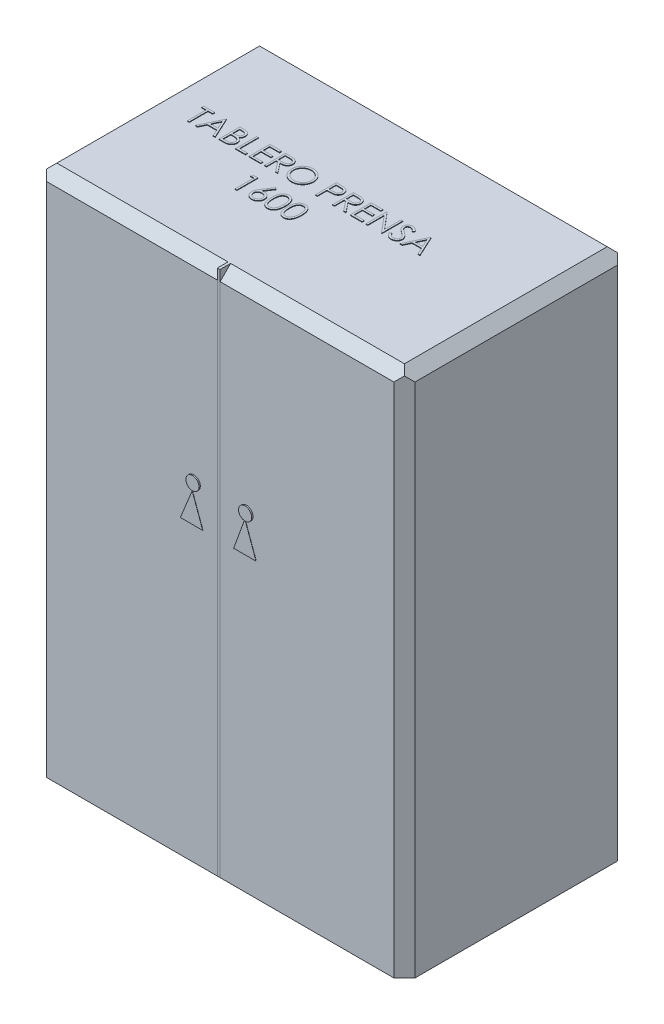
from build123d import *

# Parameters (mm, degrees)
CROQUIS1_W              = 1400
CROQUIS1_H              = 850
SALIENTE_EXTRUIR1_DEPTH = 2000
CROQUIS2_R              = 25
SALIENTE_EXTRUIR2_DEPTH = 5
CROQUIS3_W              = 10
CROQUIS3_H              = 2000
EXTRUIR_L_MINA1_DEPTH   = 0.1
SALIENTE_EXTRUIR3_DEPTH = 1
SALIENTE_EXTRUIR4_DEPTH = 1
CHAFL_N6_SIZE           = 40
CHAFL_N7_SIZE           = 40
CHAFL_N8_SIZE           = 40
CHAFL_N9_SIZE           = 40
CHAFL_N10_SIZE          = 40
CHAFL_N11_SIZE          = 40
CHAFL_N12_SIZE          = 40
CHAFL_N13_SIZE          = 40
CHAFL_N14_SIZE          = 40
SALIENTE_EXTRUIR5_DEPTH = 2
CROQUIS7_W              = 12.905507177
CROQUIS7_H              = 1960
CORTAR_EXTRUIR1_DEPTH   = 1
CROQUIS8_R              = 25.304907672
CORTAR_EXTRUIR2_DEPTH   = 2


with BuildPart() as part:
    # Croquis1 → Saliente-Extruir1 (new body)
    with BuildSketch(Plane(origin=(0, 0, 0), x_dir=(1, 0, 0), z_dir=(0, 1, 0))):
        Rectangle(CROQUIS1_W, CROQUIS1_H)
    extrude(amount=SALIENTE_EXTRUIR1_DEPTH)

    # Croquis2 → Saliente-Extruir2 (add)
    with BuildSketch(Plane.XY.offset(425)):
        with Locations(Location((100, 1250, 0), (0, 0, 180))):
            Circle(CROQUIS2_R)
        with Locations(Location((-100, 1250, 0), (0, 0, 180))):
            Circle(CROQUIS2_R)
    extrude(amount=SALIENTE_EXTRUIR2_DEPTH)

    # Croquis3 → Extruir-Lámina1 (add)
    with BuildSketch(Plane.XY.offset(425)):
        with Locations((-5, 1000)):
            Rectangle(CROQUIS3_W, CROQUIS3_H)
    extrude(amount=EXTRUIR_L_MINA1_DEPTH)

    # Chaflán6
    chafl_n6_edges = [part.edges().sort_by_distance(p)[0] for p in [
        (-700, 2000, 0),
    ]]
    chamfer(chafl_n6_edges, length=CHAFL_N6_SIZE)

    # Chaflán7
    chafl_n7_edges = [part.edges().sort_by_distance(p)[0] for p in [
        (700, 2000, 0),
    ]]
    chamfer(chafl_n7_edges, length=CHAFL_N7_SIZE)

    # Chaflán8
    chafl_n8_edges = [part.edges().sort_by_distance(p)[0] for p in [
        (330, 2000, 425),
    ]]
    chamfer(chafl_n8_edges, length=CHAFL_N8_SIZE)

    # Chaflán9
    chafl_n9_edges = [part.edges().sort_by_distance(p)[0] for p in [
        (-335, 2000, 425),
    ]]
    chamfer(chafl_n9_edges, length=CHAFL_N9_SIZE)

    # Chaflán10
    chafl_n10_edges = [part.edges().sort_by_distance(p)[0] for p in [
        (0, 2000, -425),
    ]]
    chamfer(chafl_n10_edges, length=CHAFL_N10_SIZE)

    # Chaflán11
    chafl_n11_edges = [part.edges().sort_by_distance(p)[0] for p in [
        (-700, 980, 425),
    ]]
    chamfer(chafl_n11_edges, length=CHAFL_N11_SIZE)

    # Chaflán12
    chafl_n12_edges = [part.edges().sort_by_distance(p)[0] for p in [
        (700, 980, 425),
    ]]
    chamfer(chafl_n12_edges, length=CHAFL_N12_SIZE)

    # Chaflán13
    chafl_n13_edges = [part.edges().sort_by_distance(p)[0] for p in [
        (700, 980, -425),
    ]]
    chamfer(chafl_n13_edges, length=CHAFL_N13_SIZE)

    # Chaflán14
    chafl_n14_edges = [part.edges().sort_by_distance(p)[0] for p in [
        (-700, 980, -425),
    ]]
    chamfer(chafl_n14_edges, length=CHAFL_N14_SIZE)

    # Croquis6 → Saliente-Extruir5 (add)
    # profile 1 of 17: a face of its own
    with BuildSketch(Plane(origin=(0, 2000, 0), x_dir=(1, 0, 0), z_dir=(0, 1, 0))):
        Polygon((-566.495652718, 71.233974359), (-566.495652718, 79.375), (-524.772896308, 79.375), (-524.772896308, 71.233974359), (-542.072575795, 71.233974359), (-542.072575795, 0), (-549.195973231, 0), (-549.195973231, 71.233974359), align=None)
    # profile 2 of 17: a face of its own
    with BuildSketch(Plane(origin=(0, 2000, 0), x_dir=(1, 0, 0), z_dir=(0, 1, 0))):
        Polygon((-479.997255282, 79.375), (-443.362639898, 0), (-451.106154521, 0), (-462.840679761, 25.440705128), (-498.823377077, 25.440705128), (-510.891811572, 0), (-518.667127077, 0), (-481.014883487, 79.375), align=None)
        Polygon((-480.585571588, 63.903871194), (-494.959569986, 33.581730769), (-466.593183768, 33.581730769), align=None, mode=Mode.SUBTRACT)
    # profile 3 of 17: a face of its own
    with BuildSketch(Plane(origin=(0, 2000, 0), x_dir=(1, 0, 0), z_dir=(0, 1, 0))):
        with BuildLine():
            Line((-429.115845026, 79.375), (-413.628815779, 79.375))
            add(Edge.make_bspline(
                [(-413.628815779, 79.375), (-412.870705649, 79.371014232), (-411.401299539, 79.363288822), (-409.264537198, 79.243474954), (-407.263180242, 79.080106013), (-405.396648262, 78.82088784), (-403.665803762, 78.508110037), (-402.06543056, 78.129336708), (-400.600617725, 77.675161719), (-398.851811024, 76.952933556), (-396.857896036, 75.879711702), (-394.698932487, 74.293831743), (-392.85280063, 72.354077668), (-391.261075222, 70.165988876), (-389.995585545, 67.758981195), (-389.080067552, 65.190424592), (-388.50045145, 62.493449374), (-388.440842317, 60.641898732), (-388.410716821, 59.706154848)],
                knots=[0, 0, 0, 0, 1.001505555, 1.941167018, 2.826882275, 3.653841531, 4.429895133, 5.150066043, 5.825578002, 6.45369114, 7.647487171, 8.808567382, 9.977351308, 11.170798116, 12.373658725, 13.556498008, 14.765093433, 16, 16, 16, 16], degree=3))
            add(Edge.make_bspline(
                [(-388.410716821, 59.706154848), (-388.435509453, 58.829570103), (-388.484229314, 57.106998413), (-388.950109749, 54.587542721), (-389.679467766, 52.189256151), (-390.693318952, 49.920891339), (-392.010989223, 47.833700469), (-393.572597521, 45.9108464), (-395.456660721, 44.233742072), (-396.868248485, 43.296144103), (-397.585271108, 42.819886819)],
                knots=[0, 0, 0, 0, 1.044552857, 2.05264487, 3.044412934, 4.028983338, 5.005914585, 5.980388656, 6.974128949, 8, 8, 8, 8], degree=3))
            add(Edge.make_bspline(
                [(-397.585271108, 42.819886819), (-396.68356141, 42.47369845), (-394.958367389, 41.811354343), (-392.584238179, 40.640335785), (-390.538747944, 39.366659353), (-388.806169812, 37.975740608), (-387.324405138, 36.476487221), (-386.030525927, 34.84691588), (-384.926501906, 33.065769049), (-383.98051239, 31.151617444), (-383.242353101, 29.124006465), (-382.689542413, 27.001954936), (-382.37278062, 24.793072166), (-382.327703755, 23.289814456), (-382.30494759, 22.530924479)],
                knots=[0, 0, 0, 0, 1.27268992, 2.434971085, 3.483601985, 4.442670788, 5.356604649, 6.2567628, 7.179492994, 8.113709626, 9.066344395, 10.018646069, 10.999752585, 12, 12, 12, 12], degree=3))
            add(Edge.make_bspline(
                [(-382.30494759, 22.530924479), (-382.327101062, 21.756068629), (-382.37068864, 20.231518036), (-382.692270143, 17.991892664), (-383.236762391, 15.851603696), (-383.986768746, 13.796807588), (-384.965628381, 11.831479538), (-386.156887572, 9.953393016), (-387.577281961, 8.181418018), (-389.166207739, 6.495864423), (-390.963759967, 4.980305674), (-392.903135123, 3.630574469), (-395.008757021, 2.520547703), (-397.246043314, 1.588095073), (-399.640091197, 0.875824679), (-402.180150328, 0.377518092), (-404.864030031, 0.041761003), (-406.705751172, 0.014156535), (-407.650250074, 0)],
                knots=[0, 0, 0, 0, 0.978564426, 1.925352924, 2.850884081, 3.763762016, 4.682927383, 5.618979971, 6.567305752, 7.547517671, 8.540179244, 9.531824382, 10.526200242, 11.540722885, 12.589160233, 13.674978461, 14.80764778, 16, 16, 16, 16], degree=3))
            Line((-407.650250074, 0), (-429.115845026, 0))
            Line((-429.115845026, 0), (-429.115845026, 79.375))
        make_face()
        with BuildLine():
            Line((-421.99244759, 71.233974359), (-421.99244759, 45.793269231))
            Line((-421.99244759, 45.793269231), (-417.206414938, 45.793269231))
            add(Edge.make_bspline(
                [(-417.206414938, 45.793269231), (-416.506808329, 45.802338913), (-415.155025788, 45.819863388), (-413.197413849, 45.870062793), (-411.3802929, 46.010625563), (-409.706799543, 46.151147935), (-408.179569117, 46.379625191), (-406.801985115, 46.651589407), (-405.552427649, 46.939219576), (-404.111441527, 47.428384725), (-402.476930017, 48.151324859), (-400.734464977, 49.273275428), (-399.19834397, 50.609595581), (-397.901193463, 52.151533464), (-396.839576185, 53.849391607), (-396.102211573, 55.676079789), (-395.602210664, 57.586072069), (-395.557045578, 58.897307444), (-395.534114257, 59.563050881)],
                knots=[0, 0, 0, 0, 1.156816544, 2.235205308, 3.236616184, 4.169592532, 5.011045266, 5.787822928, 6.49130361, 7.128639758, 8.301311294, 9.436451833, 10.541879658, 11.654887649, 12.756523258, 13.837046038, 14.901820046, 16, 16, 16, 16], degree=3))
            add(Edge.make_bspline(
                [(-395.534114257, 59.563050881), (-395.546047272, 60.003599628), (-395.569455183, 60.867784103), (-395.76116401, 62.127564099), (-396.087000073, 63.312377772), (-396.505517081, 64.43846206), (-397.0903677, 65.470605806), (-397.778967671, 66.444496137), (-398.610946719, 67.326967395), (-399.557942917, 68.151775661), (-400.646709899, 68.883035487), (-401.876598124, 69.523495652), (-403.264247229, 70.039223981), (-404.786270905, 70.490893867), (-406.466097353, 70.808128388), (-408.28434169, 71.072410572), (-410.255896925, 71.206956685), (-411.619901928, 71.224767593), (-412.324979641, 71.233974359)],
                knots=[0, 0, 0, 0, 0.91205012, 1.789085906, 2.630437955, 3.453916878, 4.269457761, 5.079663411, 5.91843418, 6.774407191, 7.675494373, 8.627863946, 9.638891023, 10.736472738, 11.911756761, 13.175263542, 14.539845004, 16, 16, 16, 16], degree=3))
            Line((-412.324979641, 71.233974359), (-421.99244759, 71.233974359))
        make_face(mode=Mode.SUBTRACT)
        with BuildLine():
            Line((-421.99244759, 37.65224359), (-421.99244759, 8.141025641))
            Line((-421.99244759, 8.141025641), (-411.84796642, 8.141025641))
            add(Edge.make_bspline(
                [(-411.84796642, 8.141025641), (-411.121822922, 8.149728484), (-409.722277058, 8.166502066), (-407.701588446, 8.221260714), (-405.828721628, 8.345817681), (-404.112222835, 8.5418932), (-402.533557213, 8.754583029), (-401.111662876, 9.040588864), (-399.835013668, 9.368270648), (-398.354685617, 9.874777768), (-396.687731054, 10.661644162), (-394.89134199, 11.848056083), (-393.294175971, 13.26145967), (-391.937878128, 14.897285759), (-390.826333567, 16.675996209), (-390.017718782, 18.561613967), (-389.518997567, 20.522982178), (-389.458623371, 21.86026298), (-389.428345026, 22.530924479)],
                knots=[0, 0, 0, 0, 1.160039823, 2.235823828, 3.228722157, 4.157150951, 4.99529583, 5.772374946, 6.472645482, 7.099169577, 8.269452708, 9.405989375, 10.527446681, 11.663510218, 12.788923519, 13.866172445, 14.929861265, 16, 16, 16, 16], degree=3))
            add(Edge.make_bspline(
                [(-389.428345026, 22.530924479), (-389.434606678, 22.950327023), (-389.447028981, 23.78236711), (-389.634367926, 25.005100866), (-389.906825331, 26.189509065), (-390.259056063, 27.338807822), (-390.772033263, 28.432218321), (-391.370895981, 29.491365654), (-392.073056339, 30.517649919), (-393.167165101, 31.815142096), (-394.758565464, 33.310045781), (-397.019772693, 34.773664136), (-399.590894451, 35.954034047), (-401.455696522, 36.4552186), (-402.419005082, 36.714117588)],
                knots=[0, 0, 0, 0, 0.723448775, 1.435228256, 2.130040452, 2.821711965, 3.505591119, 4.210454504, 4.921174351, 5.648778258, 7.137944449, 8.670945889, 10.280296675, 12, 12, 12, 12], degree=3))
            add(Edge.make_bspline(
                [(-402.419005082, 36.714117588), (-402.805200649, 36.792473956), (-403.642552297, 36.962366725), (-405.00797421, 37.141702141), (-406.566805522, 37.301474035), (-408.322645774, 37.419655647), (-410.277716456, 37.541814759), (-412.436193005, 37.58932231), (-414.789260677, 37.646001958), (-416.421944837, 37.650109824), (-417.270016701, 37.65224359)],
                knots=[0, 0, 0, 0, 0.634451884, 1.375622551, 2.216452059, 3.157844607, 4.20941857, 5.370758133, 6.634282058, 8, 8, 8, 8], degree=3))
            Line((-417.270016701, 37.65224359), (-421.99244759, 37.65224359))
        make_face(mode=Mode.SUBTRACT)
    # profile 4 of 17: a face of its own
    with BuildSketch(Plane(origin=(0, 2000, 0), x_dir=(1, 0, 0), z_dir=(0, 1, 0))):
        Polygon((-366.022896308, 79.375), (-358.899498872, 79.375), (-358.899498872, 8.141025641), (-328.370652718, 8.141025641), (-328.370652718, 0), (-366.022896308, 0), align=None)
    # profile 5 of 17: a face of its own
    with BuildSketch(Plane(origin=(0, 2000, 0), x_dir=(1, 0, 0), z_dir=(0, 1, 0))):
        Polygon((-315.141486052, 79.375), (-270.365845026, 79.375), (-270.365845026, 71.233974359), (-308.018088616, 71.233974359), (-308.018088616, 46.810897436), (-270.365845026, 46.810897436), (-270.365845026, 38.669871795), (-308.018088616, 38.669871795), (-308.018088616, 8.141025641), (-270.365845026, 8.141025641), (-270.365845026, 0), (-315.141486052, 0), align=None)
    # profile 6 of 17: a face of its own
    with BuildSketch(Plane(origin=(0, 2000, 0), x_dir=(1, 0, 0), z_dir=(0, 1, 0))):
        with BuildLine():
            Line((-256.119050154, 79.375), (-240.23450989, 79.375))
            add(Edge.make_bspline(
                [(-240.23450989, 79.375), (-239.174487868, 79.371471532), (-237.139128164, 79.364696483), (-234.223270069, 79.32691936), (-231.573798405, 79.218643793), (-229.192098477, 79.125466989), (-227.078213981, 78.955560462), (-225.225662923, 78.793167215), (-223.64297764, 78.58058598), (-222.684902084, 78.383159423), (-222.251111452, 78.293770032)],
                knots=[0, 0, 0, 0, 1.410062039, 2.707475311, 3.878576406, 4.937260626, 5.877586885, 6.699081471, 7.410979367, 8, 8, 8, 8], degree=3))
            add(Edge.make_bspline(
                [(-222.251111452, 78.293770032), (-221.670389798, 78.150288032), (-220.521334858, 77.866384892), (-218.866931574, 77.266318945), (-217.290446013, 76.5719096), (-215.798426783, 75.7563038), (-214.398347233, 74.81344719), (-213.075771256, 73.759616556), (-211.824697354, 72.60057814), (-210.695721099, 71.307109413), (-209.631210462, 69.950102854), (-208.733396968, 68.482714083), (-207.95945716, 66.948247298), (-207.34326865, 65.331096931), (-206.847107465, 63.646946033), (-206.497262394, 61.880539393), (-206.287458674, 60.039924422), (-206.266098736, 58.784486134), (-206.255268103, 58.147911659)],
                knots=[0, 0, 0, 0, 1.027469482, 2.033020251, 3.019912614, 3.986113645, 4.951240523, 5.91722682, 6.890402269, 7.87763091, 8.8651537, 9.85103654, 10.82876324, 11.815024772, 12.821070561, 13.842952187, 14.906261191, 16, 16, 16, 16], degree=3))
            add(Edge.make_bspline(
                [(-206.255268103, 58.147911659), (-206.288582881, 57.090294108), (-206.353588643, 55.026608336), (-206.959675816, 52.031656204), (-207.952464745, 49.237898533), (-209.320510764, 46.648852994), (-211.062666731, 44.314986573), (-213.156461101, 42.265060176), (-215.603061933, 40.549655015), (-217.880655348, 39.360100337), (-219.892566662, 38.598261159), (-221.548857863, 38.062222307), (-223.355591103, 37.648067023), (-225.295455655, 37.277042606), (-227.376524271, 36.996923822), (-229.593809093, 36.791759983), (-231.94889146, 36.663534236), (-233.56675964, 36.644438768), (-234.399048151, 36.634615385)],
                knots=[0, 0, 0, 0, 1.260483769, 2.459530307, 3.627416485, 4.787058657, 5.939039949, 7.08810263, 8.267026773, 9.491475466, 10.141966685, 10.831826277, 11.566392101, 12.351337768, 13.187381173, 14.07005841, 15.007169909, 16, 16, 16, 16], degree=3))
            Line((-234.399048151, 36.634615385), (-205.237639898, 0))
            Line((-205.237639898, 0), (-214.046484048, 0))
            Line((-214.046484048, 0), (-243.207892302, 36.634615385))
            Line((-243.207892302, 36.634615385), (-248.995652718, 36.634615385))
            Line((-248.995652718, 36.634615385), (-248.995652718, 0))
            Line((-248.995652718, 0), (-256.119050154, 0))
            Line((-256.119050154, 0), (-256.119050154, 79.375))
        make_face()
        with BuildLine():
            Line((-248.995652718, 71.233974359), (-248.995652718, 44.775641026))
            Line((-248.995652718, 44.775641026), (-234.462649914, 44.664337941))
            add(Edge.make_bspline(
                [(-234.462649914, 44.664337941), (-233.784106174, 44.664037752), (-232.468895146, 44.663455902), (-230.566147927, 44.754029041), (-228.794495394, 44.857065009), (-227.16071405, 45.014666238), (-225.664074038, 45.21777715), (-224.305323417, 45.471844829), (-223.082244204, 45.767846964), (-221.655795208, 46.225990977), (-220.062931014, 46.951841749), (-218.331842549, 48.007880737), (-216.85768239, 49.33614469), (-215.612223727, 50.855006996), (-214.611431263, 52.524971925), (-213.905854316, 54.326021727), (-213.458123929, 56.212688325), (-213.405315844, 57.509406128), (-213.378665539, 58.163812099)],
                knots=[0, 0, 0, 0, 1.146690395, 2.22261258, 3.21895312, 4.145990853, 4.996080663, 5.770904154, 6.481378293, 7.121626537, 8.300444488, 9.431385265, 10.535395872, 11.636531494, 12.74115979, 13.810798291, 14.895190096, 16, 16, 16, 16], degree=3))
            add(Edge.make_bspline(
                [(-213.378665539, 58.163812099), (-213.405927928, 58.802136182), (-213.459952035, 60.067061595), (-213.901022321, 61.918900989), (-214.646906505, 63.666669322), (-215.652071544, 65.30325675), (-216.876695237, 66.788833259), (-218.312652775, 68.059902623), (-219.920681308, 69.108774412), (-221.423617413, 69.779025541), (-222.766964732, 70.189957927), (-223.933315951, 70.479136107), (-225.251201249, 70.711466027), (-226.727019686, 70.897613122), (-228.354470955, 71.057609179), (-230.141783935, 71.165372731), (-232.077100202, 71.229187149), (-233.418468106, 71.232341486), (-234.112840218, 71.233974359)],
                knots=[0, 0, 0, 0, 1.101028733, 2.181837193, 3.264309656, 4.369019818, 5.486613113, 6.575447106, 7.666700264, 8.788928104, 9.402425223, 10.0903467, 10.862060571, 11.710948788, 12.657782767, 13.684531032, 14.801375019, 16, 16, 16, 16], degree=3))
            Line((-234.112840218, 71.233974359), (-248.995652718, 71.233974359))
        make_face(mode=Mode.SUBTRACT)
    # profile 7 of 17: a face of its own
    with BuildSketch(Plane(origin=(0, 2000, 0), x_dir=(1, 0, 0), z_dir=(0, 1, 0))):
        with BuildLine():
            add(Edge.make_bspline(
                [(-151.812159128, 81.41025641), (-150.342403869, 81.373030003), (-147.45568328, 81.299914268), (-143.213091849, 80.740227455), (-139.162810224, 79.771957004), (-135.271844576, 78.482385794), (-131.586736, 76.762116697), (-128.079746831, 74.682828512), (-124.7592213, 72.222737394), (-121.669914969, 69.400860285), (-118.842873418, 66.330556955), (-116.352179211, 63.054004352), (-114.264791478, 59.591013656), (-112.550613805, 55.951991247), (-111.20580605, 52.145166974), (-110.277820595, 48.15024584), (-109.685044689, 43.993111976), (-109.615744023, 41.157681294), (-109.580588616, 39.719300881)],
                knots=[0, 0, 0, 0, 1.065120563, 2.091984664, 3.0946048, 4.079830382, 5.057816894, 6.036188127, 7.030412546, 8.04752943, 9.064399622, 10.05169764, 11.02544977, 11.989514704, 12.962713494, 13.945757189, 14.957906945, 16, 16, 16, 16], degree=3))
            add(Edge.make_bspline(
                [(-109.580588616, 39.719300881), (-109.615738871, 38.291515937), (-109.685024097, 35.477186402), (-110.278494587, 31.346433294), (-111.209245837, 27.375626427), (-112.538125445, 23.571394659), (-114.244131831, 19.929724909), (-116.345418748, 16.460199348), (-118.820585492, 13.161680545), (-121.637419435, 10.07030403), (-124.708121638, 7.235539963), (-128.001736617, 4.765415461), (-131.444192265, 2.639886206), (-135.079787432, 0.943899315), (-138.860306125, -0.411642453), (-142.819583809, -1.335853884), (-146.93906816, -1.932006472), (-149.748285567, -2.000462102), (-151.1761415, -2.03525641)],
                knots=[0, 0, 0, 0, 1.043624062, 2.057103931, 3.04512605, 4.022047818, 4.998200453, 5.980619268, 6.982898556, 8.009068085, 9.034988726, 10.034168286, 11.015286542, 11.987931943, 12.962482838, 13.94673481, 14.956375938, 16, 16, 16, 16], degree=3))
            add(Edge.make_bspline(
                [(-151.1761415, -2.03525641), (-152.614514449, -2.00011853), (-155.449930417, -1.930852414), (-159.612288184, -1.337095555), (-163.610015589, -0.408605272), (-167.43168034, 0.918305156), (-171.079413564, 2.633195924), (-174.560349368, 4.724259521), (-177.860515743, 7.205457187), (-180.95255178, 10.021377718), (-183.781685381, 13.086875415), (-186.248192652, 16.371509414), (-188.339726471, 19.81083852), (-190.048859191, 23.414407371), (-191.401963894, 27.164795446), (-192.325091019, 31.087019847), (-192.922352789, 35.158719353), (-192.991178772, 37.931013655), (-193.026101436, 39.337690304)],
                knots=[0, 0, 0, 0, 1.053102029, 2.075944431, 3.073151272, 4.055350789, 5.033113405, 6.020478099, 7.024410459, 8.052272461, 9.079885166, 10.07527673, 11.055994387, 12.023226415, 12.992069828, 13.970394897, 14.97016774, 16, 16, 16, 16], degree=3))
            add(Edge.make_bspline(
                [(-193.026101436, 39.337690304), (-193.013976667, 40.281859765), (-192.989880087, 42.158287566), (-192.699782776, 44.944726534), (-192.278829909, 47.686353951), (-191.675536535, 50.375373664), (-190.88651123, 53.005203138), (-189.955509895, 55.593979367), (-188.818409831, 58.115467388), (-187.532973705, 60.581612164), (-186.098286273, 62.953970029), (-184.513604098, 65.196417718), (-182.834587706, 67.327772466), (-180.993917887, 69.292802732), (-179.052259219, 71.148673154), (-176.978113857, 72.866863343), (-174.784137958, 74.462866695), (-172.460891132, 75.90114943), (-170.065619541, 77.201972662), (-167.596449759, 78.318253925), (-165.086916798, 79.276334249), (-162.525266747, 80.052867249), (-159.918302094, 80.665915208), (-157.260333051, 81.083367694), (-154.553477134, 81.374204903), (-152.729863293, 81.398187537), (-151.812159128, 81.41025641)],
                knots=[0, 0, 0, 0, 1.037015668, 2.060948919, 3.074880161, 4.083647147, 5.086022904, 6.090072063, 7.104153813, 8.122640571, 9.144368836, 10.147691507, 11.138137339, 12.123020368, 13.103399296, 14.087645067, 15.080126199, 16.082011238, 17.087798457, 18.072939717, 19.057185487, 20.037253025, 21.01195951, 21.997135196, 22.992090687, 24, 24, 24, 24], degree=3))
        make_face()
        with BuildLine():
            add(Edge.make_bspline(
                [(-151.462349433, 73.269230769), (-152.215609872, 73.260048437), (-153.71492953, 73.241771555), (-155.943882406, 73.001022292), (-158.143520905, 72.657898024), (-160.314299297, 72.168459964), (-162.447134788, 71.501618052), (-164.561907972, 70.734154599), (-166.639334372, 69.799319151), (-168.672555791, 68.743116749), (-170.643665531, 67.574060866), (-172.503596439, 66.282022578), (-174.257163544, 64.897301794), (-175.900073341, 63.416666911), (-177.42750171, 61.832577727), (-178.869511903, 60.169049265), (-180.168304202, 58.378533165), (-181.358602105, 56.509582866), (-182.423765625, 54.564632721), (-183.370944205, 52.564159059), (-184.145735119, 50.491843663), (-184.77761401, 48.370169017), (-185.30148472, 46.202495379), (-185.633361213, 43.972378807), (-185.876755794, 41.691025373), (-185.893988003, 40.149294041), (-185.902704, 39.369491186)],
                knots=[0, 0, 0, 0, 1.008559885, 2.007477868, 2.99961109, 3.989939068, 4.984837346, 5.991145699, 7.001802488, 8.033829008, 9.059044045, 10.069351652, 11.065060232, 12.050310815, 13.029377138, 14.011219647, 14.996725999, 15.989392538, 16.977580475, 17.965360261, 18.951710183, 19.937753436, 20.929683414, 21.935841486, 22.955955122, 24, 24, 24, 24], degree=3))
            add(Edge.make_bspline(
                [(-185.902704, 39.369491186), (-185.873791952, 38.22281225), (-185.81691301, 35.966940046), (-185.318946687, 32.661126783), (-184.551912624, 29.484124574), (-183.421218778, 26.453316989), (-182.00719591, 23.542652003), (-180.260336077, 20.777950343), (-178.190710386, 18.1584648), (-175.839769694, 15.702482807), (-173.269772598, 13.460801175), (-170.540798187, 11.493131015), (-167.682082445, 9.82829142), (-164.686170527, 8.471997815), (-161.569056695, 7.397266261), (-158.310655091, 6.660697305), (-154.932671454, 6.175932514), (-152.630101239, 6.129378942), (-151.462349433, 6.105769231)],
                knots=[0, 0, 0, 0, 1.032063989, 2.030389145, 3.003944642, 3.970395727, 4.937377036, 5.913328081, 6.909231446, 7.93887556, 8.970685674, 9.976071282, 10.964166581, 11.944589148, 12.933237628, 13.927779006, 14.949070134, 16, 16, 16, 16], degree=3))
            add(Edge.make_bspline(
                [(-151.462349433, 6.105769231), (-150.677455379, 6.116552991), (-149.120774732, 6.137940425), (-146.805394136, 6.353356846), (-144.531726477, 6.698793885), (-142.302960844, 7.196149824), (-140.121626729, 7.818613256), (-137.978619587, 8.558109943), (-135.896765503, 9.480701527), (-133.849801324, 10.500056857), (-131.890457986, 11.66211043), (-130.020030735, 12.910297038), (-128.285664764, 14.292978258), (-126.643984037, 15.751614364), (-125.110284661, 17.315615914), (-123.694938055, 18.982949516), (-122.402710058, 20.764139421), (-121.212864144, 22.630254873), (-120.151433006, 24.580527032), (-119.226621296, 26.588253657), (-118.442030812, 28.648490959), (-117.80865222, 30.764210526), (-117.312321214, 32.931394061), (-116.970330173, 35.152943333), (-116.731106654, 37.424414136), (-116.713075439, 38.960748013), (-116.703986052, 39.735201322)],
                knots=[0, 0, 0, 0, 1.047197238, 2.076906641, 3.100256066, 4.114471768, 5.12198147, 6.126382909, 7.136867548, 8.15857795, 9.17633901, 10.174870724, 11.156907918, 12.133735059, 13.104061851, 14.077631395, 15.04955518, 16.038496417, 17.029181396, 18.010275684, 18.986308667, 19.968651475, 20.955262928, 21.950658345, 22.966943676, 24, 24, 24, 24], degree=3))
            add(Edge.make_bspline(
                [(-116.703986052, 39.735201322), (-116.713082721, 40.504356508), (-116.73112764, 42.030117503), (-116.970215904, 44.285746777), (-117.312682525, 46.49131068), (-117.806229654, 48.638150498), (-118.442367069, 50.726813477), (-119.226758311, 52.755337934), (-120.151710639, 54.731280929), (-121.213254299, 56.649758736), (-122.40650601, 58.49068583), (-123.710393314, 60.250597685), (-125.147428887, 61.896443783), (-126.676554809, 63.468855594), (-128.335965958, 64.934297019), (-130.118145485, 66.293254184), (-132.001457462, 67.578523083), (-133.995521552, 68.737977789), (-136.053464788, 69.808729138), (-138.165156335, 70.726100103), (-140.306673415, 71.505610667), (-142.472570249, 72.170477553), (-144.681077079, 72.655981094), (-146.917271054, 73.001331511), (-149.178058347, 73.241687762), (-150.698502794, 73.260020632), (-151.462349433, 73.269230769)],
                knots=[0, 0, 0, 0, 1.02996197, 2.043119294, 3.035359645, 4.018872909, 4.991431989, 5.957985074, 6.929999688, 7.912076566, 8.892894881, 9.867085534, 10.843653904, 11.817741046, 12.803660682, 13.806313499, 14.818574707, 15.856120519, 16.894564902, 17.924820532, 18.937903209, 19.946497019, 20.957711757, 21.963978472, 22.977135795, 24, 24, 24, 24], degree=3))
        make_face(mode=Mode.SUBTRACT)
    # profile 8 of 17: a face of its own
    with BuildSketch(Plane(origin=(0, 2000, 0), x_dir=(1, 0, 0), z_dir=(0, 1, 0))):
        with BuildLine():
            Line((-62.76969118, 79.375), (-47.203159729, 79.375))
            add(Edge.make_bspline(
                [(-47.203159729, 79.375), (-46.132483822, 79.373823067), (-44.081021235, 79.371568012), (-41.139269079, 79.303197884), (-38.467512665, 79.211878259), (-36.071512955, 79.085288896), (-33.943897873, 78.935687653), (-32.09429483, 78.725864617), (-30.508165606, 78.506782914), (-29.557787199, 78.284047445), (-29.124358648, 78.182466947)],
                knots=[0, 0, 0, 0, 1.415646017, 2.712440637, 3.8905458, 4.950247383, 5.884950622, 6.709939814, 7.411656543, 8, 8, 8, 8], degree=3))
            add(Edge.make_bspline(
                [(-29.124358648, 78.182466947), (-28.575683864, 78.032290585), (-27.49126313, 77.735476578), (-25.928685903, 77.140986778), (-24.442018336, 76.436087675), (-23.026159778, 75.632723325), (-21.698508966, 74.696425709), (-20.43925768, 73.665149021), (-19.259518841, 72.51508309), (-18.16592656, 71.259127026), (-17.161610615, 69.918365123), (-16.296883882, 68.472782409), (-15.572819983, 66.946711778), (-14.951806505, 65.341214718), (-14.504846912, 63.642809167), (-14.168140437, 61.863296226), (-13.954426025, 60.002866645), (-13.933957214, 58.731508935), (-13.923537334, 58.084309896)],
                knots=[0, 0, 0, 0, 0.999701418, 1.975846123, 2.934577507, 3.890451536, 4.834027766, 5.787354733, 6.749476667, 7.726910423, 8.712836071, 9.690891519, 10.682875813, 11.679750201, 12.712814741, 13.765529915, 14.8625177, 16, 16, 16, 16], degree=3))
            add(Edge.make_bspline(
                [(-13.923537334, 58.084309896), (-13.933094644, 57.431671029), (-13.951794169, 56.154739008), (-14.176227782, 54.286641847), (-14.478537485, 52.501421214), (-14.94338135, 50.803035462), (-15.552202865, 49.201570667), (-16.266397635, 47.672553441), (-17.127809842, 46.241996596), (-18.11761223, 44.904706609), (-19.218693031, 43.659428241), (-20.426393593, 42.51518558), (-21.735838262, 41.478676476), (-23.142865549, 40.547577254), (-24.661192478, 39.743479486), (-26.267791318, 39.023269178), (-27.976626583, 38.418407625), (-29.159144311, 38.100225874), (-29.760376276, 37.938451522)],
                knots=[0, 0, 0, 0, 1.121902311, 2.195077645, 3.232258892, 4.234102512, 5.217864754, 6.176164875, 7.132989551, 8.084763148, 9.034132444, 9.988522005, 10.94243251, 11.903244335, 12.886203696, 13.894208494, 14.929344452, 16, 16, 16, 16], degree=3))
            add(Edge.make_bspline(
                [(-29.760376276, 37.938451522), (-30.257656886, 37.832701773), (-31.347476257, 37.600945048), (-33.142320135, 37.342217545), (-35.232045851, 37.121382672), (-37.613801128, 36.955803302), (-40.285448079, 36.814053875), (-43.24843195, 36.701384602), (-46.508569058, 36.639475417), (-48.782577629, 36.636282438), (-49.969836412, 36.634615385)],
                knots=[0, 0, 0, 0, 0.601384939, 1.31797006, 2.144135048, 3.087295005, 4.142315834, 5.309527816, 6.595305764, 8, 8, 8, 8], degree=3))
            Line((-49.969836412, 36.634615385), (-55.646293744, 36.634615385))
            Line((-55.646293744, 36.634615385), (-55.646293744, 0))
            Line((-55.646293744, 0), (-62.76969118, 0))
            Line((-62.76969118, 0), (-62.76969118, 79.375))
        make_face()
        with BuildLine():
            Line((-55.646293744, 71.233974359), (-55.646293744, 44.775641026))
            Line((-55.646293744, 44.775641026), (-41.749308568, 44.600736178))
            add(Edge.make_bspline(
                [(-41.749308568, 44.600736178), (-41.070767393, 44.600385486), (-39.760857644, 44.599708482), (-37.868643296, 44.690087657), (-36.113111245, 44.794421166), (-34.49965391, 44.947182287), (-33.027543968, 45.163110805), (-31.694326795, 45.38109129), (-30.510340201, 45.696445049), (-29.124697589, 46.12105751), (-27.58066453, 46.845243615), (-25.900918341, 47.896392907), (-24.477371115, 49.236258968), (-23.245509742, 50.742747286), (-22.26793001, 52.418673971), (-21.552285184, 54.2118445), (-21.131798222, 56.103868945), (-21.075414902, 57.39854638), (-21.04693477, 58.052509014)],
                knots=[0, 0, 0, 0, 1.160613943, 2.240541288, 3.23993089, 4.169200891, 5.011653406, 5.7853311, 6.478053781, 7.106038997, 8.262395093, 9.384106736, 10.481365981, 11.59014053, 12.70357646, 13.786202915, 14.881775077, 16, 16, 16, 16], degree=3))
            add(Edge.make_bspline(
                [(-21.04693477, 58.052509014), (-21.075569788, 58.690650302), (-21.132492661, 59.9591962), (-21.555580987, 61.818357379), (-22.26653864, 63.592631389), (-23.252072123, 65.247556717), (-24.448165606, 66.748624236), (-25.838347137, 68.052576939), (-27.419344314, 69.100819126), (-28.890009554, 69.777395335), (-30.196322165, 70.19049176), (-31.330975541, 70.479526534), (-32.612103338, 70.710294747), (-34.040122623, 70.8971549), (-35.603965106, 71.057117324), (-37.317066175, 71.165656451), (-39.1729363, 71.229189476), (-40.461318889, 71.232340783), (-41.12919138, 71.233974359)],
                knots=[0, 0, 0, 0, 1.120700087, 2.227813068, 3.331159281, 4.466773991, 5.599788987, 6.693661531, 7.80175334, 8.91857717, 9.525282508, 10.207424825, 10.974604443, 11.810962634, 12.737642355, 13.736264703, 14.826523623, 16, 16, 16, 16], degree=3))
            Line((-41.12919138, 71.233974359), (-55.646293744, 71.233974359))
        make_face(mode=Mode.SUBTRACT)
    # profile 9 of 17: a face of its own
    with BuildSketch(Plane(origin=(0, 2000, 0), x_dir=(1, 0, 0), z_dir=(0, 1, 0))):
        with BuildLine():
            Line((2.358513948, 79.375), (18.243054213, 79.375))
            add(Edge.make_bspline(
                [(18.243054213, 79.375), (19.303076235, 79.371471532), (21.338435938, 79.364696483), (24.254294034, 79.32691936), (26.903765698, 79.218643793), (29.285465625, 79.125466989), (31.399350122, 78.955560462), (33.25190118, 78.793167215), (34.834586463, 78.58058598), (35.792662019, 78.383159423), (36.22645265, 78.293770032)],
                knots=[0, 0, 0, 0, 1.410062039, 2.707475311, 3.878576406, 4.937260626, 5.877586885, 6.699081471, 7.410979367, 8, 8, 8, 8], degree=3))
            add(Edge.make_bspline(
                [(36.22645265, 78.293770032), (36.807174305, 78.150288032), (37.956229245, 77.866384892), (39.610632528, 77.266318945), (41.187118089, 76.5719096), (42.679137319, 75.7563038), (44.07921687, 74.81344719), (45.401792846, 73.759616556), (46.652866748, 72.60057814), (47.781843004, 71.307109413), (48.846353641, 69.950102854), (49.744167134, 68.482714083), (50.518106942, 66.948247298), (51.134295453, 65.331096931), (51.630456637, 63.646946033), (51.980301709, 61.880539393), (52.190105428, 60.039924422), (52.211465367, 58.784486134), (52.222296, 58.147911659)],
                knots=[0, 0, 0, 0, 1.027469482, 2.033020251, 3.019912614, 3.986113645, 4.951240523, 5.91722682, 6.890402269, 7.87763091, 8.8651537, 9.85103654, 10.82876324, 11.815024772, 12.821070561, 13.842952187, 14.906261191, 16, 16, 16, 16], degree=3))
            add(Edge.make_bspline(
                [(52.222296, 58.147911659), (52.188981221, 57.090294108), (52.12397546, 55.026608336), (51.517888287, 52.031656204), (50.525099357, 49.237898533), (49.157053339, 46.648852994), (47.414897372, 44.314986573), (45.321103002, 42.265060176), (42.87450217, 40.549655015), (40.596908755, 39.360100337), (38.58499744, 38.598261159), (36.92870624, 38.062222307), (35.121973, 37.648067023), (33.182108447, 37.277042606), (31.101039832, 36.996923822), (28.88375501, 36.791759983), (26.528672642, 36.663534236), (24.910804462, 36.644438768), (24.078515952, 36.634615385)],
                knots=[0, 0, 0, 0, 1.260483769, 2.459530307, 3.627416485, 4.787058657, 5.939039949, 7.08810263, 8.267026773, 9.491475466, 10.141966685, 10.831826277, 11.566392101, 12.351337768, 13.187381173, 14.07005841, 15.007169909, 16, 16, 16, 16], degree=3))
            Line((24.078515952, 36.634615385), (53.239924205, 0))
            Line((53.239924205, 0), (44.431080054, 0))
            Line((44.431080054, 0), (15.269671801, 36.634615385))
            Line((15.269671801, 36.634615385), (9.481911384, 36.634615385))
            Line((9.481911384, 36.634615385), (9.481911384, 0))
            Line((9.481911384, 0), (2.358513948, 0))
            Line((2.358513948, 0), (2.358513948, 79.375))
        make_face()
        with BuildLine():
            Line((9.481911384, 71.233974359), (9.481911384, 44.775641026))
            Line((9.481911384, 44.775641026), (24.014914189, 44.664337941))
            add(Edge.make_bspline(
                [(24.014914189, 44.664337941), (24.693457929, 44.664037752), (26.008668956, 44.663455902), (27.911416176, 44.754029041), (29.683068709, 44.857065009), (31.316850053, 45.014666238), (32.813490065, 45.21777715), (34.172240686, 45.471844829), (35.395319898, 45.767846964), (36.821768895, 46.225990977), (38.414633088, 46.951841749), (40.145721553, 48.007880737), (41.619881713, 49.33614469), (42.865340376, 50.855006996), (43.86613284, 52.524971925), (44.571709786, 54.326021727), (45.019440174, 56.212688325), (45.072248258, 57.509406128), (45.098898564, 58.163812099)],
                knots=[0, 0, 0, 0, 1.146690395, 2.22261258, 3.21895312, 4.145990853, 4.996080663, 5.770904154, 6.481378293, 7.121626537, 8.300444488, 9.431385265, 10.535395872, 11.636531494, 12.74115979, 13.810798291, 14.895190096, 16, 16, 16, 16], degree=3))
            add(Edge.make_bspline(
                [(45.098898564, 58.163812099), (45.071636175, 58.802136182), (45.017612068, 60.067061595), (44.576541782, 61.918900989), (43.830657597, 63.666669322), (42.825492559, 65.30325675), (41.600868866, 66.788833259), (40.164911328, 68.059902623), (38.556882795, 69.108774412), (37.053946689, 69.779025541), (35.71059937, 70.189957927), (34.544248152, 70.479136107), (33.226362853, 70.711466027), (31.750544417, 70.897613122), (30.123093147, 71.057609179), (28.335780167, 71.165372731), (26.400463901, 71.229187149), (25.059095997, 71.232341486), (24.364723884, 71.233974359)],
                knots=[0, 0, 0, 0, 1.101028733, 2.181837193, 3.264309656, 4.369019818, 5.486613113, 6.575447106, 7.666700264, 8.788928104, 9.402425223, 10.0903467, 10.862060571, 11.710948788, 12.657782767, 13.684531032, 14.801375019, 16, 16, 16, 16], degree=3))
            Line((24.364723884, 71.233974359), (9.481911384, 71.233974359))
        make_face(mode=Mode.SUBTRACT)
    # profile 10 of 17: a face of its own
    with BuildSketch(Plane(origin=(0, 2000, 0), x_dir=(1, 0, 0), z_dir=(0, 1, 0))):
        Polygon((69.521975487, 79.375), (114.297616513, 79.375), (114.297616513, 71.233974359), (76.645372923, 71.233974359), (76.645372923, 46.810897436), (114.297616513, 46.810897436), (114.297616513, 38.669871795), (76.645372923, 38.669871795), (76.645372923, 8.141025641), (114.297616513, 8.141025641), (114.297616513, 0), (69.521975487, 0), align=None)
    # profile 11 of 17: a face of its own
    with BuildSketch(Plane(origin=(0, 2000, 0), x_dir=(1, 0, 0), z_dir=(0, 1, 0))):
        Polygon((128.544411384, 0), (128.544411384, 79.375), (130.039052811, 79.375), (182.478706256, 16.90216847), (182.478706256, 79.375), (189.602103692, 79.375), (189.602103692, 0), (187.98025874, 0), (135.66780882, 62.329727564), (135.66780882, 0), align=None)
    # profile 12 of 17: a face of its own
    with BuildSketch(Plane(origin=(0, 2000, 0), x_dir=(1, 0, 0), z_dir=(0, 1, 0))):
        with BuildLine():
            Line((201.813642154, 15.312124399), (208.523628131, 19.334935897))
            add(Edge.make_bspline(
                [(208.523628131, 19.334935897), (209.14770244, 18.290261453), (210.343404733, 16.288705532), (212.338015914, 13.584103544), (214.404780149, 11.285354632), (216.559002535, 9.405831568), (218.787533859, 7.926080029), (221.10492222, 6.878279417), (223.503358284, 6.224774261), (225.135621736, 6.145397298), (225.950511144, 6.105769231)],
                knots=[0, 0, 0, 0, 1.272034388, 2.437168799, 3.508375237, 4.49857839, 5.41946034, 6.295179144, 7.148887113, 8, 8, 8, 8], degree=3))
            add(Edge.make_bspline(
                [(225.950511144, 6.105769231), (226.646445302, 6.125151982), (228.026136405, 6.163578333), (230.057280129, 6.532803665), (232.029903145, 7.100043017), (233.903349036, 7.912410571), (235.651767437, 8.895265515), (237.184990707, 10.082402041), (238.510465059, 11.411507063), (239.594707479, 12.894292267), (240.426558279, 14.488984744), (241.065914116, 16.125832212), (241.420722037, 17.830547957), (241.474169838, 18.978320954), (241.501142154, 19.557542067)],
                knots=[0, 0, 0, 0, 1.095163259, 2.171163733, 3.241058638, 4.321873601, 5.38011039, 6.391990106, 7.366004449, 8.327778327, 9.272591725, 10.192022065, 11.087607919, 12, 12, 12, 12], degree=3))
            add(Edge.make_bspline(
                [(241.501142154, 19.557542067), (241.467706893, 20.218414909), (241.399737894, 21.561872824), (240.825256114, 23.543972096), (239.921532123, 25.505500023), (239.087807882, 26.718832296), (238.654963267, 27.348758013)],
                knots=[0, 0, 0, 0, 0.938893495, 1.908633276, 2.914225137, 4, 4, 4, 4], degree=3))
            add(Edge.make_bspline(
                [(238.654963267, 27.348758013), (238.299576124, 27.803391334), (237.553485272, 28.757837123), (236.270841683, 30.17854157), (234.765753019, 31.643995), (233.08972597, 33.210155756), (231.181707705, 34.804182574), (229.101458718, 36.502088163), (226.795867631, 38.239302499), (225.178896904, 39.404358896), (224.344566633, 40.005508814)],
                knots=[0, 0, 0, 0, 0.722233717, 1.516239348, 2.393582979, 3.351407094, 4.387010283, 5.505090956, 6.712668013, 8, 8, 8, 8], degree=3))
            add(Edge.make_bspline(
                [(224.344566633, 40.005508814), (223.509451005, 40.600335712), (221.912773518, 41.737599445), (219.679873526, 43.425435886), (217.683150883, 44.968573642), (215.931480329, 46.38153963), (214.425632329, 47.664525488), (213.153740687, 48.805210893), (212.148205553, 49.83444522), (211.589052206, 50.502132792), (211.338006136, 50.801908053)],
                knots=[0, 0, 0, 0, 1.452282411, 2.77665338, 3.964542531, 5.026858415, 5.96415736, 6.766646006, 7.446254459, 8, 8, 8, 8], degree=3))
            add(Edge.make_bspline(
                [(211.338006136, 50.801908053), (210.987110914, 51.269110139), (210.297028367, 52.187925742), (209.386120743, 53.624043052), (208.611893301, 55.094142107), (208.00496184, 56.602173321), (207.493872591, 58.126965458), (207.150112377, 59.688413352), (206.934861054, 61.279510592), (206.912817788, 62.350245338), (206.901783179, 62.886242989)],
                knots=[0, 0, 0, 0, 1.068054152, 2.10047183, 3.106115577, 4.101338837, 5.06977816, 6.043150881, 7.020423561, 8, 8, 8, 8], degree=3))
            add(Edge.make_bspline(
                [(206.901783179, 62.886242989), (206.931383455, 63.726025376), (206.98995132, 65.387640393), (207.485263051, 67.814946726), (208.267059032, 70.132388688), (209.362318096, 72.317023042), (210.774225921, 74.311965823), (212.408125697, 76.140164546), (214.354207617, 77.677059178), (216.489454609, 79.019904074), (218.826625905, 80.070963449), (221.275705321, 80.863828535), (223.840585347, 81.3130742), (225.577835007, 81.377544048), (226.459325247, 81.41025641)],
                knots=[0, 0, 0, 0, 1.005424448, 1.989358655, 2.955360095, 3.929531133, 4.905563448, 5.876582895, 6.856512386, 7.866279853, 8.892233794, 9.918561126, 10.94386622, 12, 12, 12, 12], degree=3))
            add(Edge.make_bspline(
                [(226.459325247, 81.41025641), (227.394682521, 81.377994972), (229.254809605, 81.313837269), (231.990961458, 80.756000398), (234.625320563, 79.832967305), (236.744480318, 78.785474526), (238.403026873, 77.73927992), (239.667872775, 76.786330334), (240.94960782, 75.689251978), (242.258570849, 74.445122647), (243.572582232, 73.042526685), (244.91114981, 71.49106999), (246.277403763, 69.800233812), (247.156331306, 68.59317817), (247.606911384, 67.974384014)],
                knots=[0, 0, 0, 0, 1.286793592, 2.559021753, 3.825965368, 5.121522368, 5.803751409, 6.523245864, 7.299691795, 8.125521123, 9.008227632, 9.944561021, 10.946284179, 12, 12, 12, 12], degree=3))
            Line((247.606911384, 67.974384014), (241.167232899, 63.092948718))
            add(Edge.make_bspline(
                [(241.167232899, 63.092948718), (240.778387644, 63.593888661), (240.0295626, 64.558581869), (238.892697452, 65.909574205), (237.821165615, 67.143662223), (236.765469048, 68.215567805), (235.781363478, 69.183991186), (234.826209127, 70.013114242), (233.913751518, 70.711060781), (232.763564438, 71.455905802), (231.318537611, 72.194240793), (229.504602593, 72.819014528), (227.608985284, 73.194459683), (226.31790257, 73.244100526), (225.664303211, 73.269230769)],
                knots=[0, 0, 0, 0, 1.181633172, 2.275549214, 3.290209073, 4.226197932, 5.078386478, 5.862611352, 6.581680152, 7.217281963, 8.414376989, 9.595101626, 10.782541182, 12, 12, 12, 12], degree=3))
            add(Edge.make_bspline(
                [(225.664303211, 73.269230769), (224.844324935, 73.241751145), (223.263074074, 73.188759279), (221.018116934, 72.61000247), (218.997593991, 71.698735281), (217.261491176, 70.421592028), (215.816027589, 68.908455229), (214.77042165, 67.16722048), (214.141087561, 65.244476707), (214.064291576, 63.903228429), (214.025180615, 63.220152244)],
                knots=[0, 0, 0, 0, 1.14458467, 2.207223713, 3.21896685, 4.227309161, 5.202851033, 6.127160689, 7.046193047, 8, 8, 8, 8], degree=3))
            add(Edge.make_bspline(
                [(214.025180615, 63.220152244), (214.034096166, 62.794895498), (214.051941845, 61.943686629), (214.300834578, 60.686127595), (214.620587217, 59.431745433), (215.127286187, 58.186179715), (215.826813609, 56.92764693), (216.745413134, 55.634475382), (217.902322175, 54.295266989), (218.788532991, 53.424242619), (219.256425607, 52.964367989)],
                knots=[0, 0, 0, 0, 0.858281714, 1.717966888, 2.583508476, 3.4729293, 4.427298488, 5.488583878, 6.674047936, 8, 8, 8, 8], degree=3))
            add(Edge.make_bspline(
                [(219.256425607, 52.964367989), (219.430174588, 52.80931401), (219.842962397, 52.44094125), (220.597612856, 51.837866314), (221.594172744, 51.0939463), (222.806619092, 50.173483944), (224.257307474, 49.105743642), (225.946397408, 47.904377795), (227.855060742, 46.530386135), (229.209468478, 45.569777625), (229.92562132, 45.061848958)],
                knots=[0, 0, 0, 0, 0.420754252, 0.999615792, 1.744751191, 2.668019286, 3.750313428, 4.999500688, 6.413464383, 8, 8, 8, 8], degree=3))
            add(Edge.make_bspline(
                [(229.92562132, 45.061848958), (230.787087568, 44.434982411), (232.455197561, 43.221142225), (234.828681963, 41.397429482), (236.980737968, 39.613810444), (238.918921335, 37.881675426), (240.662379794, 36.214163317), (242.191770959, 34.59121262), (243.522678353, 33.024450526), (244.955492771, 31.015751041), (246.419571893, 28.548751451), (247.676906079, 25.526191399), (248.469711459, 22.491881987), (248.573386898, 20.452469803), (248.624539589, 19.446238982)],
                knots=[0, 0, 0, 0, 1.163667725, 2.253281268, 3.268753668, 4.215851969, 5.092017293, 5.902905408, 6.650798638, 7.335211899, 8.59617414, 9.77448103, 10.901945474, 12, 12, 12, 12], degree=3))
            add(Edge.make_bspline(
                [(248.624539589, 19.446238982), (248.609636636, 18.734622488), (248.580120133, 17.325208611), (248.240827981, 15.255673832), (247.743721289, 13.245652323), (246.994484019, 11.319989595), (246.080012394, 9.443456584), (244.919634988, 7.665277414), (243.574621423, 5.946096589), (242.031712826, 4.331756695), (240.343386113, 2.849798322), (238.558952323, 1.531514249), (236.675490776, 0.432321915), (234.703218951, -0.464634681), (232.641683815, -1.166162668), (230.491578718, -1.674454521), (228.249359445, -1.986414394), (226.725348524, -2.018793984), (225.950511144, -2.03525641)],
                knots=[0, 0, 0, 0, 0.983748083, 1.948392443, 2.894712957, 3.844097841, 4.80183111, 5.778335162, 6.776009319, 7.81870978, 8.863265674, 9.881300176, 10.883814829, 11.87499822, 12.874611388, 13.892143829, 14.928324115, 16, 16, 16, 16], degree=3))
            add(Edge.make_bspline(
                [(225.950511144, -2.03525641), (225.35099533, -2.023663542), (224.159513986, -2.000623805), (222.39717395, -1.796941196), (220.670436838, -1.508762239), (219.000970085, -1.051243152), (217.3672645, -0.49614028), (215.776425431, 0.187354048), (214.227681888, 1.006440581), (212.712354562, 1.942952747), (211.234297389, 3.03283374), (209.807373741, 4.302232677), (208.384765427, 5.716139665), (207.008461974, 7.312950655), (205.650624595, 9.066867892), (204.33802495, 10.994301158), (203.043493138, 13.084751859), (202.231249493, 14.555799339), (201.813642154, 15.312124399)],
                knots=[0, 0, 0, 0, 0.915332311, 1.819136955, 2.706846663, 3.586547465, 4.459518054, 5.340707479, 6.227863349, 7.133153174, 8.059268498, 9.028702269, 10.047606654, 11.120612155, 12.245963614, 13.433783089, 14.680604001, 16, 16, 16, 16], degree=3))
        make_face()
    # profile 13 of 17: a face of its own
    with BuildSketch(Plane(origin=(0, 2000, 0), x_dir=(1, 0, 0), z_dir=(0, 1, 0))):
        Polygon((297.470693436, 79.375), (334.10530882, 0), (326.361794197, 0), (314.627268956, 25.440705128), (278.644571641, 25.440705128), (266.576137146, 0), (258.800821641, 0), (296.45306523, 79.375), align=None)
        Polygon((296.88237713, 63.903871194), (282.508378732, 33.581730769), (310.87476495, 33.581730769), align=None, mode=Mode.SUBTRACT)
    # profile 14 of 17: a face of its own
    with BuildSketch(Plane(origin=(0, 2000, 0), x_dir=(1, 0, 0), z_dir=(0, 1, 0))):
        Polygon((-242.301567181, -53.916666667), (-227.625460411, -53.916666667), (-227.625460411, -133.291666667), (-234.748857846, -133.291666667), (-234.748857846, -62.057692308), (-246.960396308, -62.057692308), align=None)
    # profile 15 of 17: a face of its own
    with BuildSketch(Plane(origin=(0, 2000, 0), x_dir=(1, 0, 0), z_dir=(0, 1, 0))):
        with BuildLine():
            Line((-161.479627077, -51.881410256), (-155.993975034, -56.190429687))
            Line((-155.993975034, -56.190429687), (-176.966656324, -88.26161859))
            add(Edge.make_bspline(
                [(-176.966656324, -88.26161859), (-175.5703304, -88.03905425), (-172.846638807, -87.604917341), (-170.089697894, -87.533299649), (-168.746128479, -87.498397436)],
                knots=[0, 0, 0, 0, 1.025318673, 2, 2, 2, 2], degree=3))
            add(Edge.make_bspline(
                [(-168.746128479, -87.498397436), (-167.93939508, -87.520080683), (-166.351364392, -87.562763511), (-164.019852985, -87.891236553), (-161.779461044, -88.408877484), (-159.639474481, -89.163444717), (-157.592212213, -90.127337397), (-155.62592573, -91.282558205), (-153.777576572, -92.688758456), (-152.02336233, -94.259588703), (-150.430712085, -95.999420315), (-149.020647968, -97.845486344), (-147.836218941, -99.795863467), (-146.875238933, -101.849563819), (-146.129003294, -104.00342167), (-145.584997772, -106.254681262), (-145.263424863, -108.60489499), (-145.219757485, -110.203239322), (-145.197575795, -111.015149239)],
                knots=[0, 0, 0, 0, 1.04369286, 2.054478336, 3.041073146, 4.015093852, 4.984733326, 5.965804835, 6.960378782, 7.985147595, 9.009457201, 10.008161701, 10.986880575, 11.956520048, 12.937015923, 13.931873656, 14.949455224, 16, 16, 16, 16], degree=3))
            add(Edge.make_bspline(
                [(-145.197575795, -111.015149239), (-145.229849781, -112.125938953), (-145.293357347, -114.311710235), (-145.926175578, -117.495253398), (-146.909510379, -120.528115804), (-148.315072184, -123.361875226), (-150.060922655, -125.992647786), (-152.189932346, -128.323675305), (-154.626597171, -130.402620794), (-157.381744201, -132.141083409), (-160.346807851, -133.560831173), (-163.461754935, -134.580578627), (-166.696334861, -135.208400165), (-168.89172508, -135.287108475), (-170.002263295, -135.326923077)],
                knots=[0, 0, 0, 0, 1.031375318, 2.029502543, 3.004789286, 3.987476834, 4.960371455, 5.9300674, 6.912260825, 7.929083631, 8.949397511, 9.960523116, 10.96833055, 12, 12, 12, 12], degree=3))
            add(Edge.make_bspline(
                [(-170.002263295, -135.326923077), (-171.070349185, -135.292265554), (-173.186040325, -135.223615069), (-176.298284052, -134.61206612), (-179.288748909, -133.620851468), (-182.136483084, -132.255277651), (-184.774468413, -130.53039352), (-187.134528382, -128.453891833), (-189.204895412, -126.070159321), (-190.927891279, -123.379565731), (-192.294473236, -120.488275624), (-193.319316181, -117.473450827), (-193.917945268, -114.346076241), (-194.001596468, -112.226057549), (-194.043729641, -111.158253205)],
                knots=[0, 0, 0, 0, 1.012016664, 2.004627821, 2.994792927, 3.992885782, 4.990978636, 5.973936114, 6.964471063, 7.975201453, 8.993600317, 9.990122807, 10.98767138, 12, 12, 12, 12], degree=3))
            add(Edge.make_bspline(
                [(-194.043729641, -111.158253205), (-194.016936156, -110.34081355), (-193.962228979, -108.67175796), (-193.580244948, -106.143913041), (-192.966454067, -103.557397437), (-192.27906098, -101.363150547), (-191.552765895, -99.56561246), (-190.948324372, -98.116372583), (-190.195985533, -96.625005386), (-189.393767781, -95.040371142), (-188.469460218, -93.40330865), (-187.464444598, -91.686457575), (-186.350934658, -89.91712243), (-185.570334539, -88.716423716), (-185.171283728, -88.102614183)],
                knots=[0, 0, 0, 0, 1.173818275, 2.396712641, 3.66331629, 4.989737886, 5.693666774, 6.447286557, 7.243889047, 8.091586357, 8.998013824, 9.943181721, 10.948533338, 12, 12, 12, 12], degree=3))
            Line((-185.171283728, -88.102614183), (-161.479627077, -51.881410256))
        make_face()
        with BuildLine():
            add(Edge.make_bspline(
                [(-170.240769906, -95.639423077), (-170.84543153, -95.657067996), (-172.026511332, -95.691533649), (-173.759322345, -95.891677755), (-175.399283583, -96.268574421), (-176.96812215, -96.748596592), (-178.436507555, -97.408612411), (-179.815111601, -98.210340709), (-181.109265457, -99.15424957), (-182.305413862, -100.226966661), (-183.389895513, -101.401445267), (-184.323824728, -102.659414787), (-185.129422016, -103.970558322), (-185.784420409, -105.34583094), (-186.294463199, -106.784706913), (-186.663403888, -108.280568461), (-186.868730032, -109.843446475), (-186.90288921, -110.903272876), (-186.920332205, -111.444461138)],
                knots=[0, 0, 0, 0, 1.129588631, 2.206414736, 3.251139165, 4.268635594, 5.265702196, 6.250456724, 7.242448911, 8.251968645, 9.246821453, 10.222880186, 11.173611482, 12.116736599, 13.062300278, 14.020270554, 14.989073742, 16, 16, 16, 16], degree=3))
            add(Edge.make_bspline(
                [(-186.920332205, -111.444461138), (-186.906127222, -111.980808896), (-186.878273364, -113.032507003), (-186.625354681, -114.582341968), (-186.23902335, -116.073796141), (-185.664339372, -117.499180613), (-184.97883673, -118.880222111), (-184.073840985, -120.166897335), (-183.071067449, -121.437352496), (-181.872415744, -122.593993009), (-180.586010905, -123.67024145), (-179.211662205, -124.610954342), (-177.779284544, -125.415730061), (-176.269539794, -126.046446024), (-174.703847872, -126.564068244), (-173.069163878, -126.928319649), (-171.364350904, -127.134253006), (-170.209514096, -127.168456682), (-169.620652718, -127.185897436)],
                knots=[0, 0, 0, 0, 0.989467248, 1.94019797, 2.891935182, 3.827694429, 4.772920941, 5.730924762, 6.725747692, 7.756678648, 8.79901574, 9.819492441, 10.826891316, 11.826466727, 12.835195252, 13.867842842, 14.912794438, 16, 16, 16, 16], degree=3))
            add(Edge.make_bspline(
                [(-169.620652718, -127.185897436), (-169.031792305, -127.168455315), (-167.876957389, -127.134248957), (-166.172130701, -126.928335038), (-164.537497404, -126.564011773), (-162.971621227, -126.046650733), (-161.462556629, -125.414970658), (-160.031431695, -124.61596105), (-158.670080288, -123.664456237), (-157.382830977, -122.595832239), (-156.189168446, -121.430769347), (-155.162344443, -120.178238142), (-154.285063975, -118.869823016), (-153.572181519, -117.50462087), (-153.003827233, -116.072934276), (-152.615536817, -114.582572858), (-152.363140443, -113.032446555), (-152.335214816, -111.98078848), (-152.320973231, -111.444461138)],
                knots=[0, 0, 0, 0, 1.087397944, 2.132534446, 3.165364764, 4.174271784, 5.174024072, 6.181601208, 7.194203697, 8.236725232, 9.267838612, 10.269026844, 11.221737037, 12.171628256, 13.107553087, 14.05945871, 15.010357665, 16, 16, 16, 16], degree=3))
            add(Edge.make_bspline(
                [(-152.320973231, -111.444461138), (-152.33345309, -110.902566858), (-152.357946995, -109.839004621), (-152.634987257, -108.281267564), (-153.019216093, -106.777106637), (-153.599402682, -105.335975293), (-154.353160036, -103.963560515), (-155.271265874, -102.652929565), (-156.333361665, -101.394034189), (-157.560216581, -100.224663356), (-158.895762958, -99.155434982), (-160.315794983, -98.211562899), (-161.801422244, -97.414978607), (-163.351138439, -96.750335394), (-164.982700242, -96.270695535), (-166.669766862, -95.893023772), (-168.433915758, -95.69204587), (-169.63081384, -95.657187428), (-170.240769906, -95.639423077)],
                knots=[0, 0, 0, 0, 0.978206639, 1.919901502, 2.851605144, 3.780102724, 4.718870031, 5.675451981, 6.667674623, 7.690630536, 8.733308323, 9.756129687, 10.767539656, 11.776269907, 12.797430371, 13.836405707, 14.897401972, 16, 16, 16, 16], degree=3))
        make_face(mode=Mode.SUBTRACT)
    # profile 16 of 17: a face of its own
    with BuildSketch(Plane(origin=(0, 2000, 0), x_dir=(1, 0, 0), z_dir=(0, 1, 0))):
        with BuildLine():
            add(Edge.make_bspline(
                [(-137.056550154, -93.635967548), (-137.049111171, -92.363758933), (-137.034660839, -89.892475362), (-136.873905578, -86.291466515), (-136.606857636, -82.913259961), (-136.240885074, -79.757693999), (-135.795523736, -76.823953983), (-135.200993951, -74.119880026), (-134.524882177, -71.632956805), (-133.741282067, -69.355074634), (-132.857094709, -67.255544583), (-131.894746296, -65.295544482), (-130.816044708, -63.478039945), (-129.682639719, -61.774022198), (-128.448651666, -60.211384834), (-127.149196953, -58.768060166), (-125.733557974, -57.477405647), (-124.249857607, -56.301605575), (-122.68466279, -55.270876485), (-121.08258804, -54.362991163), (-119.432606175, -53.587387031), (-117.730212384, -52.97755036), (-115.990707946, -52.473840085), (-114.20801197, -52.129376451), (-112.379181038, -51.912639419), (-111.144753856, -51.89191874), (-110.518714617, -51.881410256)],
                knots=[0, 0, 0, 0, 1.646270934, 3.197905019, 4.663502075, 6.030701355, 7.308322542, 8.50163776, 9.611534131, 10.641858119, 11.616356847, 12.558055219, 13.465016945, 14.349605745, 15.204443733, 16.039544428, 16.859896111, 17.680448484, 18.487036065, 19.28249412, 20.06191084, 20.843045899, 21.620316918, 22.403196591, 23.190181807, 24, 24, 24, 24], degree=3))
            add(Edge.make_bspline(
                [(-110.518714617, -51.881410256), (-109.88744573, -51.892473208), (-108.632050528, -51.914473937), (-106.776027733, -52.125927634), (-104.962883165, -52.476790604), (-103.200346805, -52.973926992), (-101.473940862, -53.590686088), (-99.79716876, -54.363733208), (-98.159615302, -55.263593235), (-96.587303424, -56.320956167), (-95.062971969, -57.499839931), (-93.624062809, -58.832493312), (-92.270444968, -60.30546016), (-90.985130006, -61.902981002), (-89.804583427, -63.655696319), (-88.680328803, -65.533121666), (-87.674034417, -67.568089493), (-86.704873034, -69.726646531), (-85.86832887, -72.068518794), (-85.113897951, -74.580505327), (-84.504321342, -77.292277064), (-83.99656463, -80.189606199), (-83.603207168, -83.283133051), (-83.316716893, -86.566226277), (-83.165380857, -90.041045851), (-83.136880669, -92.416804216), (-83.122255282, -93.635967548)],
                knots=[0, 0, 0, 0, 0.810914788, 1.612654377, 2.396697861, 3.181598691, 3.963628158, 4.749916497, 5.551656086, 6.361998678, 7.18212741, 8.025565596, 8.878627764, 9.750805457, 10.657531673, 11.591944965, 12.560506719, 13.57287815, 14.630710178, 15.753379473, 16.941251878, 18.199788006, 19.531962791, 20.947069417, 22.433333509, 24, 24, 24, 24], degree=3))
            add(Edge.make_bspline(
                [(-83.122255282, -93.635967548), (-83.137032289, -94.849813317), (-83.165824684, -97.214942297), (-83.315020355, -100.674126916), (-83.608903598, -103.939796826), (-83.976522976, -107.0197841), (-84.485678743, -109.901269384), (-85.111724478, -112.594223841), (-85.806830013, -115.110276895), (-86.664869094, -117.428816372), (-87.604004846, -119.582185801), (-88.625792331, -121.593030058), (-89.72048303, -123.479122767), (-90.91312064, -125.225367028), (-92.184331975, -126.844133001), (-93.561324685, -128.306846943), (-95.005282597, -129.648753254), (-96.534099885, -130.842816948), (-98.130933279, -131.887954482), (-99.762862345, -132.822625731), (-101.458842645, -133.57629578), (-103.180439966, -134.223429745), (-104.952279698, -134.71783285), (-106.772153201, -135.059686359), (-108.630803551, -135.29944078), (-109.887231902, -135.317730591), (-110.518714617, -135.326923077)],
                knots=[0, 0, 0, 0, 1.561518951, 3.042555995, 4.452378317, 5.7783523, 7.031515105, 8.214008947, 9.334062868, 10.386615937, 11.391082383, 12.354592575, 13.286541444, 14.194233754, 15.072674879, 15.931287219, 16.775624067, 17.606195743, 18.42308326, 19.229000347, 20.022332153, 20.807536673, 21.593273796, 22.3848459, 23.188221202, 24, 24, 24, 24], degree=3))
            add(Edge.make_bspline(
                [(-110.518714617, -135.326923077), (-111.144736488, -135.316346801), (-112.379129425, -135.29549245), (-114.208211216, -135.079734611), (-115.983545201, -134.732854449), (-117.713891944, -134.247156463), (-119.408128983, -133.652641426), (-121.04316977, -132.878084672), (-122.637194025, -131.98604418), (-124.185948956, -130.970148015), (-125.660331894, -129.806245559), (-127.06863955, -128.518912583), (-128.375492662, -127.076024505), (-129.59183733, -125.500364463), (-130.74785683, -123.806428432), (-131.811240832, -121.971088543), (-132.794829844, -120.001622198), (-133.693887579, -117.885305295), (-134.491009055, -115.591256039), (-135.195126721, -113.093230026), (-135.751072792, -110.369178993), (-136.226936244, -107.44098156), (-136.610757073, -104.296054925), (-136.872792665, -100.932691741), (-137.034747489, -97.352987896), (-137.049149979, -94.897584085), (-137.056550154, -93.635967548)],
                knots=[0, 0, 0, 0, 0.810891512, 1.598919785, 2.382837074, 3.152667961, 3.926044502, 4.706494248, 5.493654104, 6.291793342, 7.103789334, 7.925228297, 8.761435821, 9.622817696, 10.50288917, 11.416980706, 12.369136599, 13.353924996, 14.394355917, 15.514179734, 16.714354668, 17.994756427, 19.357759367, 20.818452758, 22.365282078, 24, 24, 24, 24], degree=3))
        make_face()
        with BuildLine():
            add(Edge.make_bspline(
                [(-129.933152718, -93.604166667), (-129.930443829, -94.664360372), (-129.925186408, -96.721988173), (-129.787840431, -99.712004985), (-129.600736955, -102.50079637), (-129.359407537, -105.091903358), (-129.00101924, -107.476555428), (-128.599454587, -109.671153597), (-128.110774698, -111.664083796), (-127.532584114, -113.469021646), (-126.874018881, -115.116598735), (-126.154975187, -116.649697721), (-125.38252665, -118.086429136), (-124.518038771, -119.413887755), (-123.576536444, -120.636402547), (-122.579285746, -121.775611423), (-121.48906821, -122.791542964), (-119.980858335, -124.009991284), (-117.989759718, -125.269085924), (-115.481045823, -126.365506175), (-112.903207738, -127.054536883), (-111.153527602, -127.142161349), (-110.280208007, -127.185897436)],
                knots=[0, 0, 0, 0, 1.459021318, 2.831673884, 4.118529203, 5.306027144, 6.411944654, 7.436330062, 8.375795394, 9.233974572, 10.042671642, 10.816086306, 11.563610507, 12.285937304, 12.993564865, 13.685989202, 14.367179055, 15.041617293, 16.353048772, 17.594441528, 18.799311195, 20, 20, 20, 20], degree=3))
            add(Edge.make_bspline(
                [(-110.280208007, -127.185897436), (-109.401239382, -127.14966205), (-107.645116874, -127.07726609), (-105.07940402, -126.378794724), (-102.588610394, -125.324931954), (-100.636621749, -124.078801028), (-99.151571209, -122.892069271), (-98.087560897, -121.880272782), (-97.110975156, -120.747345077), (-96.184735244, -119.524986045), (-95.335216921, -118.189842207), (-94.56271362, -116.748333804), (-93.857787702, -115.196457805), (-93.456171839, -114.113108364), (-93.250836011, -113.559219752)],
                knots=[0, 0, 0, 0, 1.353760809, 2.704726607, 4.075137775, 5.516104923, 6.260822281, 7.007110065, 7.778089737, 8.566572457, 9.372053459, 10.217411131, 11.088608312, 12, 12, 12, 12], degree=3))
            add(Edge.make_bspline(
                [(-93.250836011, -113.559219752), (-93.011536992, -112.850973874), (-92.525657357, -111.412931007), (-91.899461762, -109.182183897), (-91.406307173, -106.841692643), (-90.962637985, -104.405444461), (-90.659809753, -101.85547267), (-90.416064702, -99.199667178), (-90.272493766, -96.43602557), (-90.254696733, -94.558353448), (-90.245652718, -93.604166667)],
                knots=[0, 0, 0, 0, 0.884706709, 1.796334032, 2.740027952, 3.714592787, 4.726048262, 5.777819803, 6.87074269, 8, 8, 8, 8], degree=3))
            add(Edge.make_bspline(
                [(-90.245652718, -93.604166667), (-90.258130224, -92.650134218), (-90.282538893, -90.783842803), (-90.375838257, -88.050662634), (-90.61676575, -85.454697342), (-90.88435291, -82.984763409), (-91.278897031, -80.654533329), (-91.704297294, -78.444499621), (-92.275824787, -76.382041737), (-92.886326827, -74.43486908), (-93.585062582, -72.625104237), (-94.354222984, -70.944309439), (-95.175680728, -69.384370145), (-96.067906538, -67.949566292), (-97.020308636, -66.633471122), (-98.058024484, -65.462472281), (-99.13989151, -64.400276755), (-100.655209832, -63.187822062), (-102.639001761, -61.951574682), (-105.107465549, -60.813886914), (-107.676281946, -60.160555992), (-109.412858494, -60.068442733), (-110.280208007, -60.022435897)],
                knots=[0, 0, 0, 0, 1.31362396, 2.569729283, 3.763502607, 4.902122613, 5.988968491, 7.01645872, 7.998833611, 8.933434873, 9.825090667, 10.667526885, 11.477055099, 12.250526234, 12.991942729, 13.710640831, 14.402115721, 15.076753259, 16.378508321, 17.609869233, 18.806226677, 20, 20, 20, 20], degree=3))
            add(Edge.make_bspline(
                [(-110.280208007, -60.022435897), (-111.158108934, -60.068506205), (-112.915510115, -60.16073075), (-115.511026231, -60.811452751), (-117.998964206, -61.945675372), (-119.977510239, -63.191916676), (-121.493885397, -64.37887481), (-122.561653622, -65.408174751), (-123.562825742, -66.534080876), (-124.485111084, -67.767838588), (-125.348921614, -69.093749597), (-126.142241006, -70.522244797), (-126.857009018, -72.060563236), (-127.51660475, -73.707400253), (-128.09655905, -75.512182386), (-128.574940001, -77.502657776), (-129.016878527, -79.690275679), (-129.329735519, -82.087843092), (-129.60785998, -84.67959907), (-129.786597692, -87.475352537), (-129.925645853, -90.470384021), (-129.930600312, -92.538650651), (-129.933152718, -93.604166667)],
                knots=[0, 0, 0, 0, 1.207732386, 2.417664972, 3.655092373, 4.956220595, 5.625982001, 6.301752483, 6.994047911, 7.697131622, 8.419323945, 9.170223765, 9.943494443, 10.752040957, 11.610060368, 12.549350801, 13.567764191, 14.679664412, 15.874934091, 17.154273443, 18.533957287, 20, 20, 20, 20], degree=3))
        make_face(mode=Mode.SUBTRACT)
    # profile 17 of 17: a face of its own
    with BuildSketch(Plane(origin=(0, 2000, 0), x_dir=(1, 0, 0), z_dir=(0, 1, 0))):
        with BuildLine():
            add(Edge.make_bspline(
                [(-75.998857846, -93.635967548), (-75.991418863, -92.363758933), (-75.976968531, -89.892475362), (-75.81621327, -86.291466515), (-75.549165329, -82.913259961), (-75.183192766, -79.757693999), (-74.737831429, -76.823953983), (-74.143301643, -74.119880026), (-73.46718987, -71.632956805), (-72.683589759, -69.355074634), (-71.799402401, -67.255544583), (-70.837053988, -65.295544482), (-69.758352401, -63.478039945), (-68.624947411, -61.774022198), (-67.390959358, -60.211384834), (-66.091504646, -58.768060166), (-64.675865666, -57.477405647), (-63.1921653, -56.301605575), (-61.626970482, -55.270876485), (-60.024895732, -54.362991163), (-58.374913867, -53.587387031), (-56.672520077, -52.97755036), (-54.933015639, -52.473840085), (-53.150319662, -52.129376451), (-51.32148873, -51.912639419), (-50.087061548, -51.89191874), (-49.46102231, -51.881410256)],
                knots=[0, 0, 0, 0, 1.646270934, 3.197905019, 4.663502075, 6.030701355, 7.308322542, 8.50163776, 9.611534131, 10.641858119, 11.616356847, 12.558055219, 13.465016945, 14.349605745, 15.204443733, 16.039544428, 16.859896111, 17.680448484, 18.487036065, 19.28249412, 20.06191084, 20.843045899, 21.620316918, 22.403196591, 23.190181807, 24, 24, 24, 24], degree=3))
            add(Edge.make_bspline(
                [(-49.46102231, -51.881410256), (-48.829753423, -51.892473208), (-47.574358221, -51.914473937), (-45.718335425, -52.125927634), (-43.905190858, -52.476790604), (-42.142654498, -52.973926992), (-40.416248555, -53.590686088), (-38.739476453, -54.363733208), (-37.101922994, -55.263593235), (-35.529611116, -56.320956167), (-34.005279661, -57.499839931), (-32.566370501, -58.832493312), (-31.21275266, -60.30546016), (-29.927437698, -61.902981002), (-28.746891119, -63.655696319), (-27.622636495, -65.533121666), (-26.61634211, -67.568089493), (-25.647180726, -69.726646531), (-24.810636563, -72.068518794), (-24.056205643, -74.580505327), (-23.446629034, -77.292277064), (-22.938872322, -80.189606199), (-22.545514861, -83.283133051), (-22.259024585, -86.566226277), (-22.107688549, -90.041045851), (-22.079188361, -92.416804216), (-22.064562975, -93.635967548)],
                knots=[0, 0, 0, 0, 0.810914788, 1.612654377, 2.396697861, 3.181598691, 3.963628158, 4.749916497, 5.551656086, 6.361998678, 7.18212741, 8.025565596, 8.878627764, 9.750805457, 10.657531673, 11.591944965, 12.560506719, 13.57287815, 14.630710178, 15.753379473, 16.941251878, 18.199788006, 19.531962791, 20.947069417, 22.433333509, 24, 24, 24, 24], degree=3))
            add(Edge.make_bspline(
                [(-22.064562975, -93.635967548), (-22.079339981, -94.849813317), (-22.108132376, -97.214942297), (-22.257328047, -100.674126916), (-22.55121129, -103.939796826), (-22.918830668, -107.0197841), (-23.427986435, -109.901269384), (-24.05403217, -112.594223841), (-24.749137705, -115.110276895), (-25.607176786, -117.428816372), (-26.546312539, -119.582185801), (-27.568100023, -121.593030058), (-28.662790722, -123.479122767), (-29.855428332, -125.225367028), (-31.126639667, -126.844133001), (-32.503632377, -128.306846943), (-33.947590289, -129.648753254), (-35.476407577, -130.842816948), (-37.073240971, -131.887954482), (-38.705170037, -132.822625731), (-40.401150338, -133.57629578), (-42.122747659, -134.223429745), (-43.89458739, -134.71783285), (-45.714460893, -135.059686359), (-47.573111244, -135.29944078), (-48.829539595, -135.317730591), (-49.46102231, -135.326923077)],
                knots=[0, 0, 0, 0, 1.561518951, 3.042555995, 4.452378317, 5.7783523, 7.031515105, 8.214008947, 9.334062868, 10.386615937, 11.391082383, 12.354592575, 13.286541444, 14.194233754, 15.072674879, 15.931287219, 16.775624067, 17.606195743, 18.42308326, 19.229000347, 20.022332153, 20.807536673, 21.593273796, 22.3848459, 23.188221202, 24, 24, 24, 24], degree=3))
            add(Edge.make_bspline(
                [(-49.46102231, -135.326923077), (-50.08704418, -135.316346801), (-51.321437117, -135.29549245), (-53.150518908, -135.079734611), (-54.925852893, -134.732854449), (-56.656199637, -134.247156463), (-58.350436675, -133.652641426), (-59.985477462, -132.878084672), (-61.579501717, -131.98604418), (-63.128256648, -130.970148015), (-64.602639586, -129.806245559), (-66.010947242, -128.518912583), (-67.317800354, -127.076024505), (-68.534145022, -125.500364463), (-69.690164522, -123.806428432), (-70.753548525, -121.971088543), (-71.737137536, -120.001622198), (-72.636195271, -117.885305295), (-73.433316747, -115.591256039), (-74.137434414, -113.093230026), (-74.693380485, -110.369178993), (-75.169243936, -107.44098156), (-75.553064766, -104.296054925), (-75.815100358, -100.932691741), (-75.977055181, -97.352987896), (-75.991457671, -94.897584085), (-75.998857846, -93.635967548)],
                knots=[0, 0, 0, 0, 0.810891512, 1.598919785, 2.382837074, 3.152667961, 3.926044502, 4.706494248, 5.493654104, 6.291793342, 7.103789334, 7.925228297, 8.761435821, 9.622817696, 10.50288917, 11.416980706, 12.369136599, 13.353924996, 14.394355917, 15.514179734, 16.714354668, 17.994756427, 19.357759367, 20.818452758, 22.365282078, 24, 24, 24, 24], degree=3))
        make_face()
        with BuildLine():
            add(Edge.make_bspline(
                [(-68.875460411, -93.604166667), (-68.872751522, -94.664360372), (-68.8674941, -96.721988173), (-68.730148123, -99.712004985), (-68.543044647, -102.50079637), (-68.301715229, -105.091903358), (-67.943326932, -107.476555428), (-67.54176228, -109.671153597), (-67.05308239, -111.664083796), (-66.474891806, -113.469021646), (-65.816326573, -115.116598735), (-65.097282879, -116.649697721), (-64.324834342, -118.086429136), (-63.460346463, -119.413887755), (-62.518844137, -120.636402547), (-61.521593438, -121.775611423), (-60.431375903, -122.791542964), (-58.923166027, -124.009991284), (-56.932067411, -125.269085924), (-54.423353515, -126.365506175), (-51.845515431, -127.054536883), (-50.095835295, -127.142161349), (-49.222515699, -127.185897436)],
                knots=[0, 0, 0, 0, 1.459021318, 2.831673884, 4.118529203, 5.306027144, 6.411944654, 7.436330062, 8.375795394, 9.233974572, 10.042671642, 10.816086306, 11.563610507, 12.285937304, 12.993564865, 13.685989202, 14.367179055, 15.041617293, 16.353048772, 17.594441528, 18.799311195, 20, 20, 20, 20], degree=3))
            add(Edge.make_bspline(
                [(-49.222515699, -127.185897436), (-48.343547074, -127.14966205), (-46.587424566, -127.07726609), (-44.021711712, -126.378794724), (-41.530918087, -125.324931954), (-39.578929441, -124.078801028), (-38.093878901, -122.892069271), (-37.02986859, -121.880272782), (-36.053282848, -120.747345077), (-35.127042937, -119.524986045), (-34.277524613, -118.189842207), (-33.505021312, -116.748333804), (-32.800095394, -115.196457805), (-32.398479531, -114.113108364), (-32.193143704, -113.559219752)],
                knots=[0, 0, 0, 0, 1.353760809, 2.704726607, 4.075137775, 5.516104923, 6.260822281, 7.007110065, 7.778089737, 8.566572457, 9.372053459, 10.217411131, 11.088608312, 12, 12, 12, 12], degree=3))
            add(Edge.make_bspline(
                [(-32.193143704, -113.559219752), (-31.953844684, -112.850973874), (-31.467965049, -111.412931007), (-30.841769454, -109.182183897), (-30.348614865, -106.841692643), (-29.904945677, -104.405444461), (-29.602117445, -101.85547267), (-29.358372394, -99.199667178), (-29.214801458, -96.43602557), (-29.197004425, -94.558353448), (-29.187960411, -93.604166667)],
                knots=[0, 0, 0, 0, 0.884706709, 1.796334032, 2.740027952, 3.714592787, 4.726048262, 5.777819803, 6.87074269, 8, 8, 8, 8], degree=3))
            add(Edge.make_bspline(
                [(-29.187960411, -93.604166667), (-29.200437916, -92.650134218), (-29.224846585, -90.783842803), (-29.318145949, -88.050662634), (-29.559073442, -85.454697342), (-29.826660602, -82.984763409), (-30.221204723, -80.654533329), (-30.646604986, -78.444499621), (-31.218132479, -76.382041737), (-31.828634519, -74.43486908), (-32.527370275, -72.625104237), (-33.296530677, -70.944309439), (-34.11798842, -69.384370145), (-35.010214231, -67.949566292), (-35.962616329, -66.633471122), (-37.000332177, -65.462472281), (-38.082199203, -64.400276755), (-39.597517524, -63.187822062), (-41.581309454, -61.951574682), (-44.049773241, -60.813886914), (-46.618589638, -60.160555992), (-48.355166186, -60.068442733), (-49.222515699, -60.022435897)],
                knots=[0, 0, 0, 0, 1.31362396, 2.569729283, 3.763502607, 4.902122613, 5.988968491, 7.01645872, 7.998833611, 8.933434873, 9.825090667, 10.667526885, 11.477055099, 12.250526234, 12.991942729, 13.710640831, 14.402115721, 15.076753259, 16.378508321, 17.609869233, 18.806226677, 20, 20, 20, 20], degree=3))
            add(Edge.make_bspline(
                [(-49.222515699, -60.022435897), (-50.100416627, -60.068506205), (-51.857817807, -60.16073075), (-54.453333923, -60.811452751), (-56.941271898, -61.945675372), (-58.919817931, -63.191916676), (-60.436193089, -64.37887481), (-61.503961314, -65.408174751), (-62.505133434, -66.534080876), (-63.427418777, -67.767838588), (-64.291229306, -69.093749597), (-65.084548698, -70.522244797), (-65.799316711, -72.060563236), (-66.458912442, -73.707400253), (-67.038866742, -75.512182386), (-67.517247694, -77.502657776), (-67.95918622, -79.690275679), (-68.272043211, -82.087843092), (-68.550167672, -84.67959907), (-68.728905384, -87.475352537), (-68.867953545, -90.470384021), (-68.872908005, -92.538650651), (-68.875460411, -93.604166667)],
                knots=[0, 0, 0, 0, 1.207732386, 2.417664972, 3.655092373, 4.956220595, 5.625982001, 6.301752483, 6.994047911, 7.697131622, 8.419323945, 9.170223765, 9.943494443, 10.752040957, 11.610060368, 12.549350801, 13.567764191, 14.679664412, 15.874934091, 17.154273443, 18.533957287, 20, 20, 20, 20], degree=3))
        make_face(mode=Mode.SUBTRACT)
    extrude(amount=SALIENTE_EXTRUIR5_DEPTH)

    # Croquis7 → Cortar-Extruir1 (cut)
    with BuildSketch(Plane(origin=(0, 0, -425), x_dir=(-1, 0, 0), z_dir=(0, 0, -1))):
        with Locations((1.179879309, 980)):
            Rectangle(CROQUIS7_W, CROQUIS7_H)
    extrude(amount=-CORTAR_EXTRUIR1_DEPTH, mode=Mode.SUBTRACT)

    # Croquis8 → Cortar-Extruir2 (cut)
    with BuildSketch(Plane(origin=(0, 0, -425), x_dir=(-1, 0, 0), z_dir=(0, 0, -1))):
        with Locations((-139.176992198, 935.628988513)):
            Circle(CROQUIS8_R)
        with Locations((118.089569137, 935.628988513)):
            Circle(CROQUIS8_R)
    extrude(amount=-CORTAR_EXTRUIR2_DEPTH, mode=Mode.SUBTRACT)


with BuildPart() as body_2:
    # Croquis4 → Saliente-Extruir3 (new body)
    with BuildSketch(Plane.XY.offset(430)):
        with BuildLine():
            Line((97.536725769, 1225.121650375), (57.5, 1115.121650375))
            Line((57.5, 1115.121650375), (142.5, 1115.121650375))
            Line((142.5, 1115.121650375), (102.463274231, 1225.121650375))
            ThreePointArc((102.463274231, 1225.121650375), (100, 1225), (97.536725769, 1225.121650375))
        make_face()
    extrude(amount=SALIENTE_EXTRUIR3_DEPTH)


with BuildPart() as body_3:
    # Croquis5 → Saliente-Extruir4 (new body)
    with BuildSketch(Plane.XY.offset(430)):
        Polygon((-100, 1225), (-144.963274231, 1115), (-59.963274231, 1115), align=None)
    extrude(amount=SALIENTE_EXTRUIR4_DEPTH)


solid = Compound([part.part, body_2.part, body_3.part])
